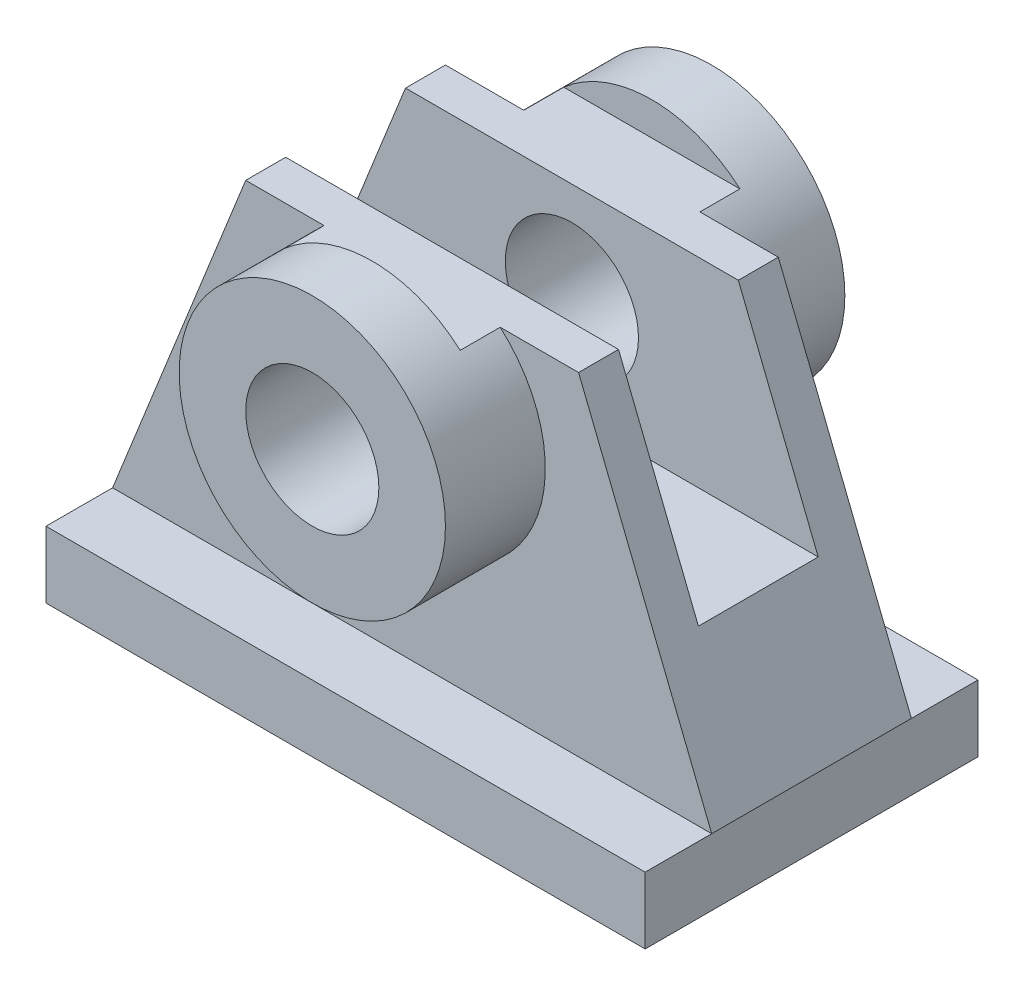
from build123d import *

# Parameters (mm, degrees)
SKETCH1_W           = 90
SKETCH1_H           = 10
BOSS_EXTRUDE1_DEPTH = 25
BOSS_EXTRUDE2_START = 9
SKETCH1_3_R         = 20
SKETCH1_3_R_2       = 10
BOSS_EXTRUDE2_DEPTH = 6
BOSS_EXTRUDE3_START = 15
SKETCH1_4_R         = 10
BOSS_EXTRUDE3_DEPTH = 15
SKETCH1_5_R         = 10
CUT_EXTRUDE1_DEPTH  = 47.5
SKETCH2_W           = 42
SKETCH2_H           = 15
CUT_EXTRUDE2_DEPTH  = 110.658560997
BOSS_EXTRUDE4_START = -6
BOSS_EXTRUDE4_DEPTH = 18


with BuildPart() as part:
    # Sketch1 → Boss-Extrude1 (new, symmetric)
    with BuildSketch(Plane.XY):
        with Locations((0, -5)):
            Rectangle(SKETCH1_W, SKETCH1_H)
    extrude(amount=BOSS_EXTRUDE1_DEPTH, both=True)

    # Sketch1<3> → Boss-Extrude2 (add)
    # profile 1 of 3: a face of its own
    with BuildSketch(Plane.XY.offset(BOSS_EXTRUDE2_START)):
        Polygon((-25, 50), (25, 50), (45, 0), (-45, 0), align=None)
        with Locations((0, 35)):
            Circle(SKETCH1_3_R, mode=Mode.SUBTRACT)
    # profile 2 of 3: a face of its own
    with BuildSketch(Plane.XY.offset(BOSS_EXTRUDE2_START)):
        with BuildLine():
            Line((13.228756555, 50), (-13.228756555, 50))
            ThreePointArc((-13.228756555, 50), (-8.228756555, 16.771243445), (20, 35))
            ThreePointArc((20, 35), (18.228756555, 43.228756555), (13.228756555, 50))
        make_face()
        with Locations((0, 35)):
            Circle(SKETCH1_3_R_2, mode=Mode.SUBTRACT)
    # profile 3 of 3: a face of its own
    with BuildSketch(Plane.XY.offset(BOSS_EXTRUDE2_START)):
        with Locations((0, 35)):
            Circle(SKETCH1_3_R_2)
    boss_extrude2 = extrude(amount=BOSS_EXTRUDE2_DEPTH)

    # Mirror1: Boss-Extrude2 across plane
    add(boss_extrude2.mirror(Plane.XY))

    # Sketch1<4> → Boss-Extrude3 (add)
    # profile 1 of 2: a face of its own
    with BuildSketch(Plane.XY.offset(BOSS_EXTRUDE3_START)):
        with BuildLine():
            Line((13.228756555, 50), (-13.228756555, 50))
            ThreePointArc((-13.228756555, 50), (-8.228756555, 16.771243445), (20, 35))
            ThreePointArc((20, 35), (18.228756555, 43.228756555), (13.228756555, 50))
        make_face()
        with Locations((0, 35)):
            Circle(SKETCH1_4_R, mode=Mode.SUBTRACT)
    # profile 2 of 2: a face of its own
    with BuildSketch(Plane.XY.offset(BOSS_EXTRUDE3_START)):
        with BuildLine():
            ThreePointArc((13.228756555, 50), (0, 55), (-13.228756555, 50))
            Line((-13.228756555, 50), (13.228756555, 50))
        make_face()
    boss_extrude3 = extrude(amount=BOSS_EXTRUDE3_DEPTH)

    # Mirror2: Boss-Extrude3 across plane
    add(boss_extrude3.mirror(Plane.XY))

    # Sketch1<5> → Cut-Extrude1 (cut, symmetric)
    with BuildSketch(Plane.XY):
        with Locations((0, 35)):
            Circle(SKETCH1_5_R)
    extrude(amount=CUT_EXTRUDE1_DEPTH, both=True, mode=Mode.SUBTRACT)

    # Sketch2 → Cut-Extrude2 (cut, through all)
    with BuildSketch(Plane.ZY.offset(45)):
        with Locations((0, 57.5)):
            Rectangle(SKETCH2_W, SKETCH2_H)
    extrude(amount=-CUT_EXTRUDE2_DEPTH, mode=Mode.SUBTRACT)

    # Sketch3 → Boss-Extrude4 (add)
    with BuildSketch(Plane(origin=(0, 0, -15), x_dir=(-1, 0, 0), z_dir=(0, 0, -1)).offset(BOSS_EXTRUDE4_START)):
        Polygon((-45, 0), (-37, 20), (37, 20), (45, 0), align=None)
    extrude(amount=-BOSS_EXTRUDE4_DEPTH)


solid = part.part
